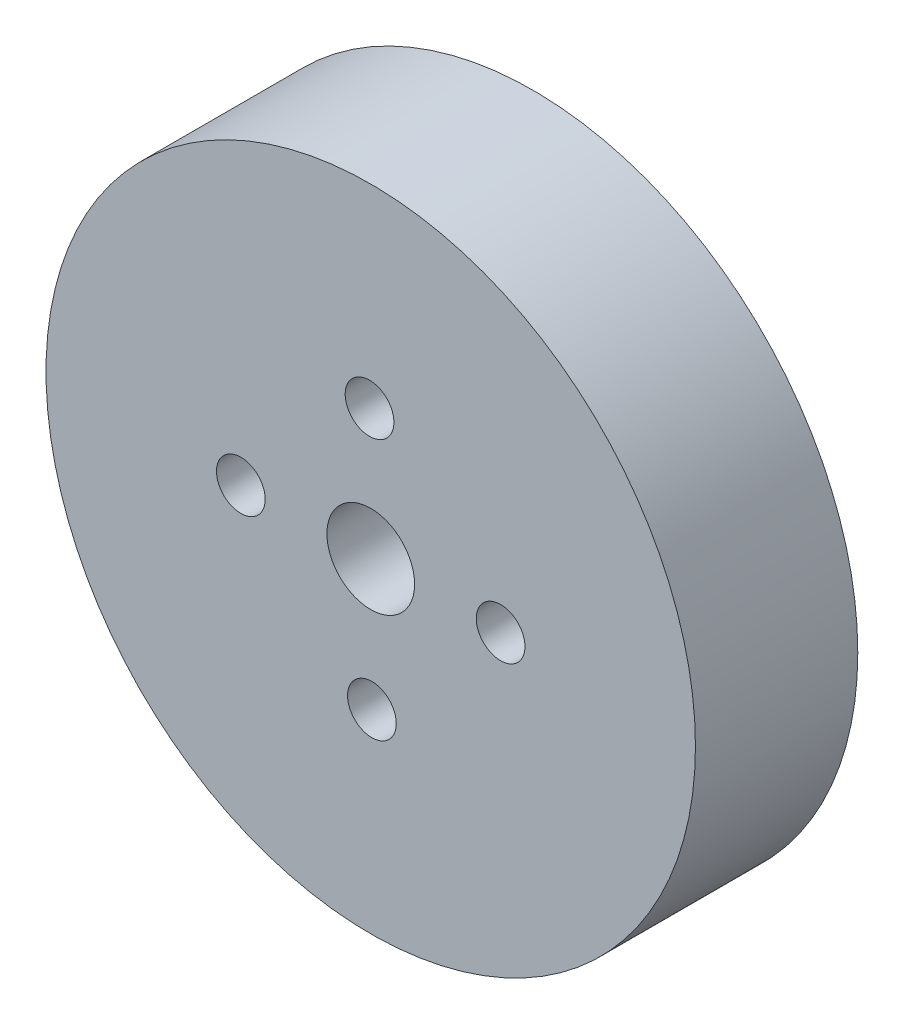
from build123d import *

# Parameters (mm, degrees)
SKETCH1_R           = 20
SKETCH1_R_2         = 1.5
SKETCH1_R_3         = 2.7
BOSS_EXTRUDE1_DEPTH = 10


with BuildPart() as part:
    # Sketch1 → Boss-Extrude1 (new body)
    with BuildSketch(Plane.XY):
        Circle(SKETCH1_R)
        with Locations((-8, -0.072631711)):
            Circle(SKETCH1_R_2, mode=Mode.SUBTRACT)
        with Locations((-0.072631711, 8)):
            Circle(SKETCH1_R_2, mode=Mode.SUBTRACT)
        with Locations((8, 0.072631711)):
            Circle(SKETCH1_R_2, mode=Mode.SUBTRACT)
        with Locations((0.072631711, -8)):
            Circle(SKETCH1_R_2, mode=Mode.SUBTRACT)
        Circle(SKETCH1_R_3, mode=Mode.SUBTRACT)
    extrude(amount=BOSS_EXTRUDE1_DEPTH)


solid = part.part
